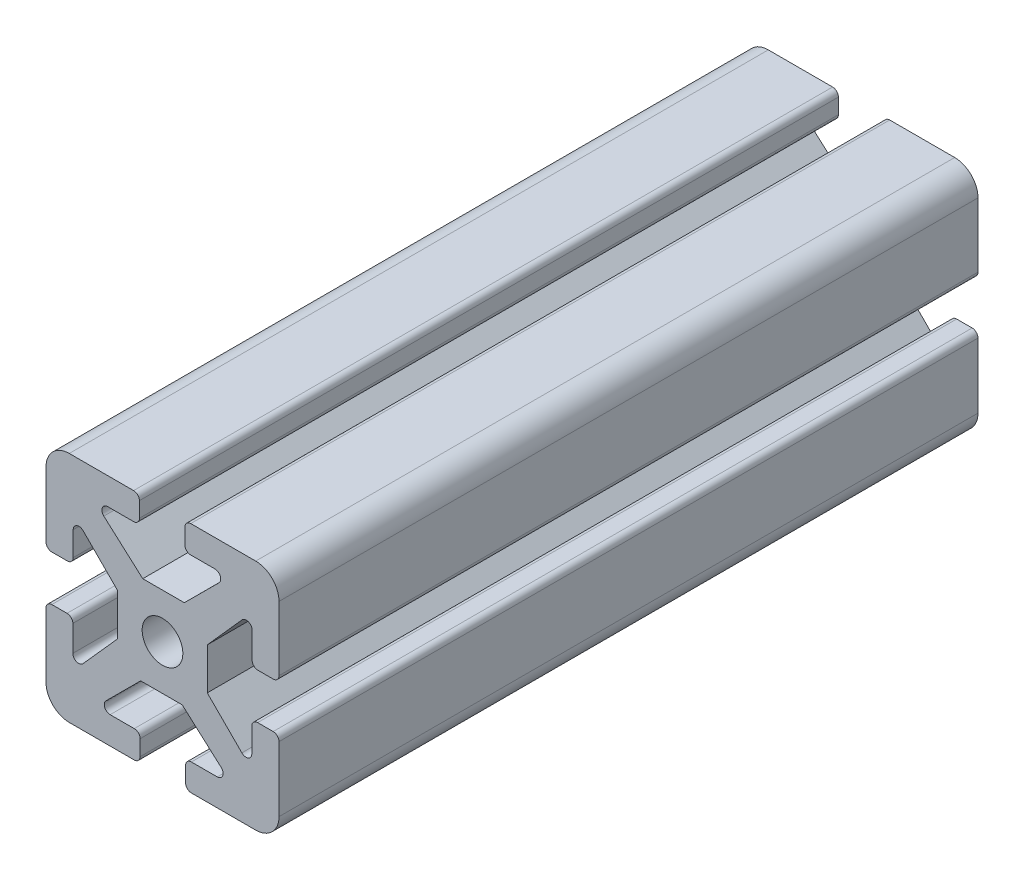
from build123d import *

# Parameters (mm, degrees)
SKETCH2_R           = 3.492543695
BOSS_EXTRUDE1_DEPTH = 120


with BuildPart() as part:
    # Sketch2 → Boss-Extrude1 (new body)
    with BuildSketch(Plane.XY):
        with BuildLine():
            Line((19.48831917, 27.684671829), (23.749889801, 27.684671829))
            Line((23.749889801, 27.684671829), (29.699681879, 33.624984685))
            ThreePointArc((29.699681879, 33.624984685), (29.917171057, 34.714970099), (28.993139054, 35.332654972))
            Line((28.993139054, 35.332654972), (24.845630957, 35.332654972))
            ThreePointArc((24.845630957, 35.332654972), (24.138524175, 35.625548191), (23.845630957, 36.332654972))
            Line((23.845630957, 36.332654972), (23.845630957, 39))
            ThreePointArc((23.845630957, 39), (24.138524175, 39.707106781), (24.845630957, 40))
            Line((24.845630957, 40), (36, 40))
            ThreePointArc((36, 40), (38.828427125, 38.828427125), (40, 36))
            Line((40, 36), (40, 24.961087436))
            ThreePointArc((40, 24.961087436), (39.707106781, 24.253980655), (39, 23.961087436))
            Line((39, 23.961087436), (36.388269628, 23.961087436))
            ThreePointArc((36.388269628, 23.961087436), (35.681162846, 24.253980655), (35.388269628, 24.961087436))
            Line((35.388269628, 24.961087436), (35.388269628, 29.408620307))
            ThreePointArc((35.388269628, 29.408620307), (34.744223919, 30.343123673), (33.641676542, 30.073901274))
            Line((33.641676542, 30.073901274), (27.684671829, 23.388818206))
            Line((27.684671829, 23.388818206), (27.684671829, 20.51168083))
            Line((27.684671829, 20.51168083), (27.684671829, 16.250110199))
            Line((27.684671829, 16.250110199), (33.624984685, 10.300318121))
            ThreePointArc((33.624984685, 10.300318121), (34.714970099, 10.082828943), (35.332654972, 11.006860946))
            Line((35.332654972, 11.006860946), (35.332654972, 15.154369043))
            ThreePointArc((35.332654972, 15.154369043), (35.625548191, 15.861475825), (36.332654972, 16.154369043))
            Line((36.332654972, 16.154369043), (39, 16.154369043))
            ThreePointArc((39, 16.154369043), (39.707106781, 15.861475825), (40, 15.154369043))
            Line((40, 15.154369043), (40, 4))
            ThreePointArc((40, 4), (38.828427125, 1.171572875), (36, 0))
            Line((36, 0), (24.961087436, 0))
            ThreePointArc((24.961087436, 0), (24.253980655, 0.292893219), (23.961087436, 1))
            Line((23.961087436, 1), (23.961087436, 3.611730372))
            ThreePointArc((23.961087436, 3.611730372), (24.253980655, 4.318837154), (24.961087436, 4.611730372))
            Line((24.961087436, 4.611730372), (29.408620307, 4.611730372))
            ThreePointArc((29.408620307, 4.611730372), (30.343123673, 5.255776081), (30.073901274, 6.358323458))
            Line((30.073901274, 6.358323458), (23.388818206, 12.315328171))
            Line((23.388818206, 12.315328171), (20.51168083, 12.315328171))
            Line((20.51168083, 12.315328171), (16.250110199, 12.315328171))
            Line((16.250110199, 12.315328171), (10.300318121, 6.375015315))
            ThreePointArc((10.300318121, 6.375015315), (10.082828943, 5.285029901), (11.006860946, 4.667345028))
            Line((11.006860946, 4.667345028), (15.154369043, 4.667345028))
            ThreePointArc((15.154369043, 4.667345028), (15.861475825, 4.374451809), (16.154369043, 3.667345028))
            Line((16.154369043, 3.667345028), (16.154369043, 1))
            ThreePointArc((16.154369043, 1), (15.861475825, 0.292893219), (15.154369043, 0))
            Line((15.154369043, 0), (4, 0))
            ThreePointArc((4, 0), (1.171572875, 1.171572875), (0, 4))
            Line((0, 4), (0, 15.038912564))
            ThreePointArc((0, 15.038912564), (0.292893219, 15.746019345), (1, 16.038912564))
            Line((1, 16.038912564), (3.611730372, 16.038912564))
            ThreePointArc((3.611730372, 16.038912564), (4.318837154, 15.746019345), (4.611730372, 15.038912564))
            Line((4.611730372, 15.038912564), (4.611730372, 10.591379693))
            ThreePointArc((4.611730372, 10.591379693), (5.255776081, 9.656876327), (6.358323458, 9.926098726))
            Line((6.358323458, 9.926098726), (12.315328171, 16.611181794))
            Line((12.315328171, 16.611181794), (12.315328171, 19.48831917))
            Line((12.315328171, 19.48831917), (12.315328171, 23.749889801))
            Line((12.315328171, 23.749889801), (6.375015315, 29.699681879))
            ThreePointArc((6.375015315, 29.699681879), (5.285029901, 29.917171057), (4.667345028, 28.993139054))
            Line((4.667345028, 28.993139054), (4.667345028, 24.845630957))
            ThreePointArc((4.667345028, 24.845630957), (4.374451809, 24.138524175), (3.667345028, 23.845630957))
            Line((3.667345028, 23.845630957), (1, 23.845630957))
            ThreePointArc((1, 23.845630957), (0.292893219, 24.138524175), (0, 24.845630957))
            Line((0, 24.845630957), (0, 36))
            ThreePointArc((0, 36), (1.171572875, 38.828427125), (4, 40))
            Line((4, 40), (15.038912564, 40))
            ThreePointArc((15.038912564, 40), (15.746019345, 39.707106781), (16.038912564, 39))
            Line((16.038912564, 39), (16.038912564, 36.388269628))
            ThreePointArc((16.038912564, 36.388269628), (15.746019345, 35.681162846), (15.038912564, 35.388269628))
            Line((15.038912564, 35.388269628), (10.591379693, 35.388269628))
            ThreePointArc((10.591379693, 35.388269628), (9.656876327, 34.744223919), (9.926098726, 33.641676542))
            Line((9.926098726, 33.641676542), (16.611181794, 27.684671829))
            Line((16.611181794, 27.684671829), (19.48831917, 27.684671829))
        make_face()
        with Locations((20, 20)):
            Circle(SKETCH2_R, mode=Mode.SUBTRACT)
    extrude(amount=BOSS_EXTRUDE1_DEPTH)


solid = part.part
